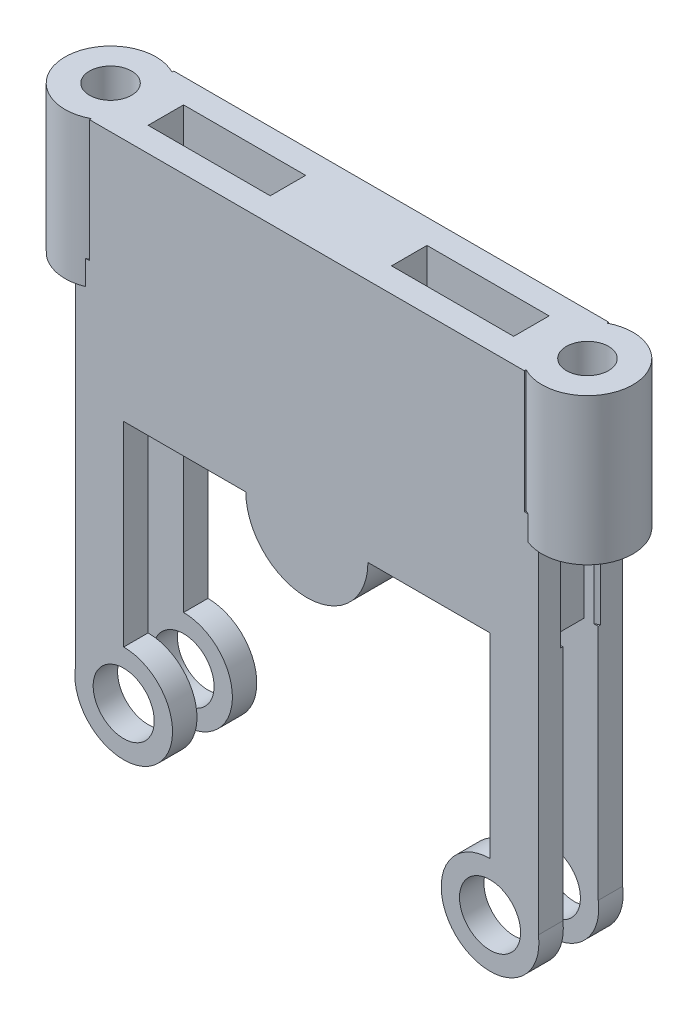
from build123d import *

# Parameters (mm, degrees)
SKETCH1_W                = 22.609360872
SKETCH1_H                = 4.3815
SKETCH1_W_2              = 7.366
SKETCH1_H_2              = 1.8415
SKETCH1_W_3              = 7.407296779
BOSS_EXTRUDE1_DEPTH      = 6.35
BOSS_EXTRUDE2_REACH      = 15.15
BOSS_EXTRUDE3_START      = 2.19075
BOSS_EXTRUDE3_DEPTH      = 2.19075
SKETCH7_R                = 1.5875
BOSS_EXTRUDE4_DEPTH      = 1.27
MIRROR2_COPY_1_SKETCH_R  = 1.5875
MIRROR2_COPY_1_DEPTH     = 1.27
BOSS_EXTRUDE5_DEPTH      = 6.35
BOSS_EXTRUDE5_DEPTH_BACK = 1.27
SKETCH8_R                = 2.367055436
SKETCH8_R_2              = 1.095375
SKETCH9_W                = 22.609360872
SKETCH9_H                = 6.35
BOSS_EXTRUDE6_DEPTH      = 4.3815
SKETCH10_W               = 6.35
SKETCH10_H               = 1.8415
CUT_EXTRUDE1_DEPTH       = 12.7
SKETCH12_R               = 1.095375
CUT_EXTRUDE2_DEPTH       = 12.7


with BuildPart() as part:
    # Sketch1 → Boss-Extrude1 (new body)
    with BuildSketch(Plane(origin=(0, 0, 0), x_dir=(1, 0, 0), z_dir=(0, 1, 0))):
        Rectangle(SKETCH1_W, SKETCH1_H)
        with Locations((-6.35, 0)):
            Rectangle(SKETCH1_W_2, SKETCH1_H_2, mode=Mode.SUBTRACT)
        with Locations((6.329351611, 0)):
            Rectangle(SKETCH1_W_3, SKETCH1_H_2, mode=Mode.SUBTRACT)
    extrude(amount=BOSS_EXTRUDE1_DEPTH)

    # Boss-Extrude2: up to this face of the body (flat: up to its plane)
    boss_extrude2_end = Plane(part.part.faces().sort_by_distance((0, 3.175, -2.19075))[0])
    # Sketch2 → Boss-Extrude2 (add, up to the picked face)
    with BuildSketch(Plane.XY, mode=Mode.PRIVATE) as boss_extrude2_sk1:
        with BuildLine():
            Line((3.175, 0), (-3.175, 0))
            ThreePointArc((-3.175, 0), (0, -3.175), (3.175, 0))
        make_face()
    boss_extrude2_tool1 = split(extrude(boss_extrude2_sk1.sketch, amount=-BOSS_EXTRUDE2_REACH, mode=Mode.PRIVATE), bisect_by=boss_extrude2_end, keep=Keep.BOTH, mode=Mode.PRIVATE)
    add(boss_extrude2_tool1.solids().sort_by(Axis((0, -1.347512, 0), (0, 0, -1)))[0])

    # Sketch2<3> → Boss-Extrude3 (add)
    with BuildSketch(Plane.XY.offset(BOSS_EXTRUDE3_START)):
        with BuildLine():
            Line((3.175, 0), (-3.175, 0))
            ThreePointArc((-3.175, 0), (0, -3.175), (3.175, 0))
        make_face()
    extrude(amount=-BOSS_EXTRUDE3_DEPTH)

    # Sketch7 → Boss-Extrude4 (add)
    with BuildSketch(Plane.XY.offset(2.19075)):
        with BuildLine():
            Line((-9.525, 0), (-9.525, -10.16))
            ThreePointArc((-9.525, -10.16), (-7.860334077, -14.618459634), (-12.039641241, -12.341978452))
            Line((-12.039641241, -12.341978452), (-12.039641241, 0))
            Line((-12.039641241, 0), (-12.039641241, 6.35))
            Line((-12.039641241, 6.35), (-11.304680436, 6.35))
            Line((-11.304680436, 6.35), (-11.304680436, 0))
            Line((-11.304680436, 0), (-9.525, 0))
        make_face()
        with Locations((-9.525, -12.7)):
            Circle(SKETCH7_R, mode=Mode.SUBTRACT)
    boss_extrude4 = extrude(amount=-BOSS_EXTRUDE4_DEPTH)

    # Mirror1: Boss-Extrude4 across plane
    add(boss_extrude4.mirror(Plane(origin=(0, 0, 0), x_dir=(0, 0, 1), z_dir=(1, 0, 0))))

    # Mirror2: Boss-Extrude4 across plane
    add(boss_extrude4.mirror(Plane.XY))

    # Mirror2 copy 1 sketch → Mirror2 copy 1 (add)
    with BuildSketch(Plane(origin=(0, 0, -2.19075), x_dir=(-1, 0, 0), z_dir=(0, 0, -1))):
        with BuildLine():
            Line((-9.525, 0), (-9.525, -10.16))
            ThreePointArc((-9.525, -10.16), (-7.860334077, -14.618459634), (-12.039641241, -12.341978452))
            Line((-12.039641241, -12.341978452), (-12.039641241, 0))
            Line((-12.039641241, 0), (-12.039641241, 6.35))
            Line((-12.039641241, 6.35), (-11.304680436, 6.35))
            Line((-11.304680436, 6.35), (-11.304680436, 0))
            Line((-11.304680436, 0), (-9.525, 0))
        make_face()
        with Locations((-9.525, -12.7)):
            Circle(MIRROR2_COPY_1_SKETCH_R, mode=Mode.SUBTRACT)
    extrude(amount=-MIRROR2_COPY_1_DEPTH)

    # Sketch8 → Boss-Extrude5 (add, two sides: drawn at the far end of the back side and taken through both)
    # profile 1 of 2: a face of its own
    with BuildSketch(Plane(origin=(0, 6.35, 0), x_dir=(1, 0, 0), z_dir=(0, 1, 0)).offset(-BOSS_EXTRUDE5_DEPTH_BACK)):
        with Locations(Location((-12.400055436, 0, 0), (0, 0, 67.746440803))):
            Circle(SKETCH8_R)
        with Locations(Location((-12.400055436, 0, 0), (0, 0, 70.789925107))):
            Circle(SKETCH8_R_2, mode=Mode.SUBTRACT)
    # profile 2 of 2: a face of its own
    with BuildSketch(Plane(origin=(0, 6.35, 0), x_dir=(1, 0, 0), z_dir=(0, 1, 0)).offset(-BOSS_EXTRUDE5_DEPTH_BACK)):
        with Locations(Location((12.400055436, 0, 0), (0, 0, 90))):
            Circle(SKETCH8_R)
        with Locations(Location((12.400055436, 0, 0), (0, 0, 90))):
            Circle(SKETCH8_R_2, mode=Mode.SUBTRACT)
    extrude(amount=BOSS_EXTRUDE5_DEPTH + BOSS_EXTRUDE5_DEPTH_BACK)

    # Sketch9 → Boss-Extrude6 (add)
    with BuildSketch(Plane(origin=(0, 0, -2.19075), x_dir=(-1, 0, 0), z_dir=(0, 0, -1))):
        with Locations((0, 9.525)):
            Rectangle(SKETCH9_W, SKETCH9_H)
    extrude(amount=-BOSS_EXTRUDE6_DEPTH)

    # Sketch10 → Cut-Extrude1 (cut)
    with BuildSketch(Plane(origin=(0, 12.7, 0), x_dir=(1, 0, 0), z_dir=(0, 1, 0))):
        with Locations((6.308703221, 0)):
            Rectangle(SKETCH10_W, SKETCH10_H)
        with Locations((-6.35, 0)):
            Rectangle(SKETCH10_W, SKETCH10_H)
    extrude(amount=-CUT_EXTRUDE1_DEPTH, mode=Mode.SUBTRACT)

    # Sketch12 → Cut-Extrude2 (cut)
    with BuildSketch(Plane(origin=(0, 12.7, 0), x_dir=(1, 0, 0), z_dir=(0, 1, 0))):
        with Locations(Location((-12.400055436, 0, 0), (0, 0, 70.789925107))):
            Circle(SKETCH12_R)
        with Locations(Location((12.400055436, 0, 0), (0, 0, 90))):
            Circle(SKETCH12_R)
    extrude(amount=-CUT_EXTRUDE2_DEPTH, mode=Mode.SUBTRACT)


solid = part.part
